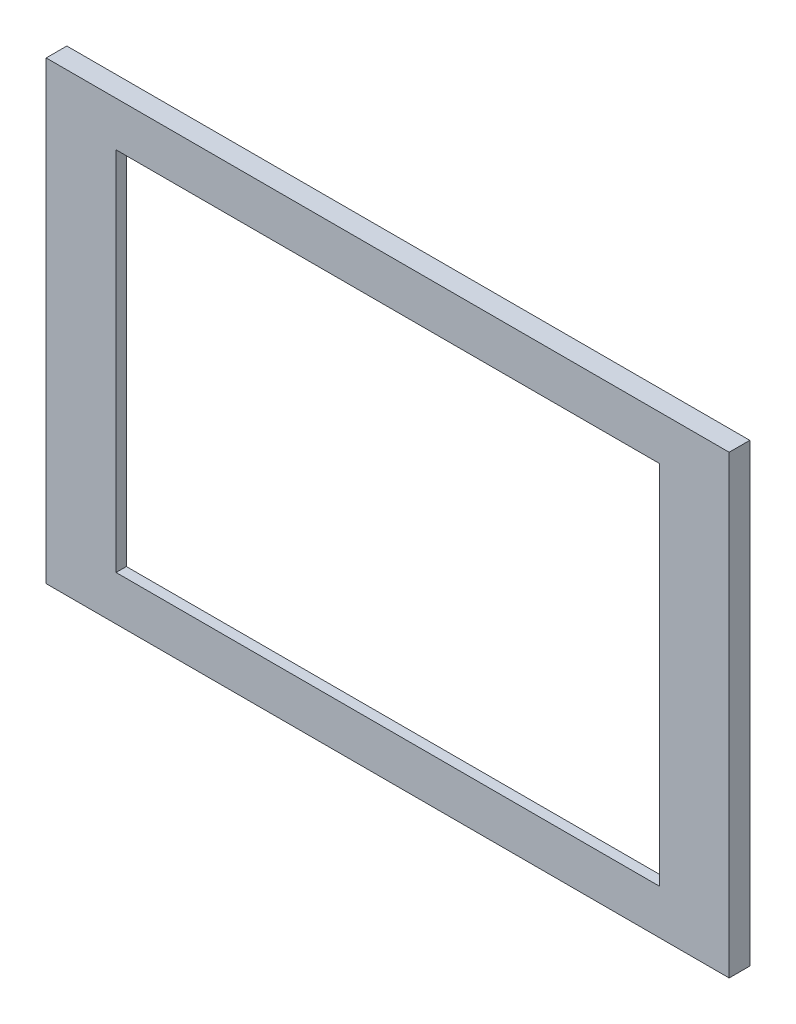
from build123d import *

# Parameters (mm, degrees)
SKETCH1_W           = 113.52
SKETCH1_H           = 111.28
SKETCH1_R           = 8.5
SKETCH1_W_2         = 6
SKETCH1_H_2         = 5.8
SKETCH1_W_3         = 83.52
SKETCH1_H_3         = 56.28
BOSS_EXTRUDE1_DEPTH = 3.175
SKETCH3_W           = 96.645
SKETCH3_H           = 61.08
SKETCH3_W_2         = 83.52
SKETCH3_H_2         = 56.28
CUT_EXTRUDE1_DEPTH  = 1.5875
SKETCH4_W           = 113.52
SKETCH4_H           = 111.28
SKETCH4_W_2         = 105
SKETCH4_H_2         = 70
CUT_EXTRUDE2_DEPTH  = 10


with BuildPart() as part:
    # Sketch1 → Boss-Extrude1 (new body)
    with BuildSketch(Plane.XY):
        with Locations((0, -12.5)):
            Rectangle(SKETCH1_W, SKETCH1_H)
        with Locations((-41.76, -53.14)):
            Circle(SKETCH1_R, mode=Mode.SUBTRACT)
        with Locations((41.76, -53.14)):
            Circle(SKETCH1_R, mode=Mode.SUBTRACT)
        with Locations((-7.5, -53.14)):
            Rectangle(SKETCH1_W_2, SKETCH1_H_2, mode=Mode.SUBTRACT)
        Rectangle(SKETCH1_W_3, SKETCH1_H_3, mode=Mode.SUBTRACT)
        with Locations((-22.5, -53.14)):
            Rectangle(SKETCH1_W_2, SKETCH1_H_2, mode=Mode.SUBTRACT)
        with Locations((7.5, -53.14)):
            Rectangle(SKETCH1_W_2, SKETCH1_H_2, mode=Mode.SUBTRACT)
        with Locations((22.5, -53.14)):
            Rectangle(SKETCH1_W_2, SKETCH1_H_2, mode=Mode.SUBTRACT)
    extrude(amount=BOSS_EXTRUDE1_DEPTH)

    # Sketch3 → Cut-Extrude1 (cut)
    with BuildSketch(Plane(origin=(0, 0, 0), x_dir=(-1, 0, 0), z_dir=(0, 0, -1))):
        with Locations((0.9375, 0)):
            Rectangle(SKETCH3_W, SKETCH3_H)
        Rectangle(SKETCH3_W_2, SKETCH3_H_2, mode=Mode.SUBTRACT)
    extrude(amount=-CUT_EXTRUDE1_DEPTH, mode=Mode.SUBTRACT)

    # Sketch4 → Cut-Extrude2 (cut)
    with BuildSketch(Plane.XY.offset(3.175)):
        with Locations((0, -12.5)):
            Rectangle(SKETCH4_W, SKETCH4_H)
        Rectangle(SKETCH4_W_2, SKETCH4_H_2, mode=Mode.SUBTRACT)
    extrude(amount=-CUT_EXTRUDE2_DEPTH, mode=Mode.SUBTRACT)


solid = part.part
